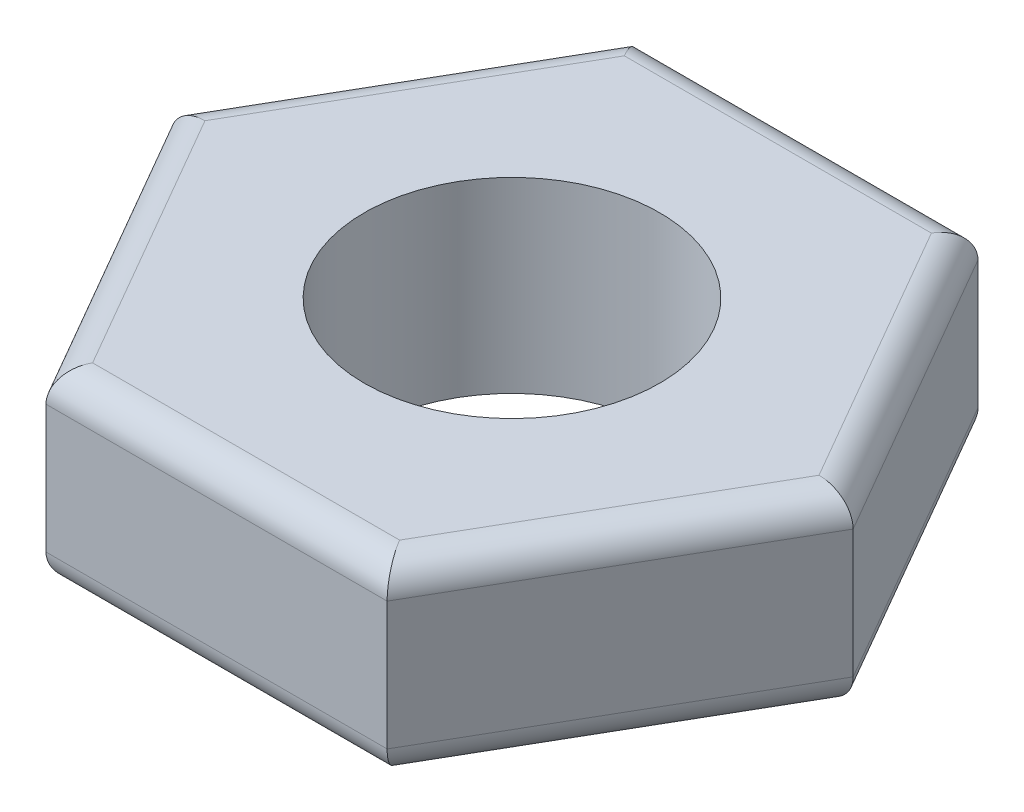
from build123d import *

# Parameters (mm, degrees)
BOSS_EXTRUDE1_DEPTH = 1.9
SKETCH2_R           = 1.5
CUT_EXTRUDE1_DEPTH  = 2.3
FILLET1_R           = 0.3


with BuildPart() as part:
    # Sketch1 → Boss-Extrude1 (new body)
    with BuildSketch(Plane(origin=(0, 0, 0), x_dir=(1, 0, 0), z_dir=(0, 1, 0))):
        Polygon((1.732050808, -3), (3.464101615, 0), (1.732050808, 3), (-1.732050808, 3), (-3.464101615, 0), (-1.732050808, -3), align=None)
    extrude(amount=BOSS_EXTRUDE1_DEPTH)

    # Sketch2 → Cut-Extrude1 (cut)
    with BuildSketch(Plane(origin=(0, 1.9, 0), x_dir=(1, 0, 0), z_dir=(0, 1, 0))):
        with Locations(Location((0, 0, 0), (0, 0, 270))):
            Circle(SKETCH2_R)
    extrude(amount=-CUT_EXTRUDE1_DEPTH, mode=Mode.SUBTRACT)

    # Fillet1
    fillet1_edges = [part.edges().sort_by_distance(p)[0] for p in [
        (2.598076211, 1.9, -1.5),
        (0, 1.9, -3),
        (-2.598076211, 1.9, -1.5),
        (-2.598076211, 1.9, 1.5),
        (0, 1.9, 3),
        (-2.598076211, 0, 1.5),
        (-2.598076211, 0, -1.5),
        (0, 0, -3),
        (2.598076211, 0, -1.5),
        (2.598076211, 0, 1.5),
        (0, 0, 3),
        (2.598076211, 1.9, 1.5),
    ]]
    fillet(fillet1_edges, radius=FILLET1_R)


solid = part.part
